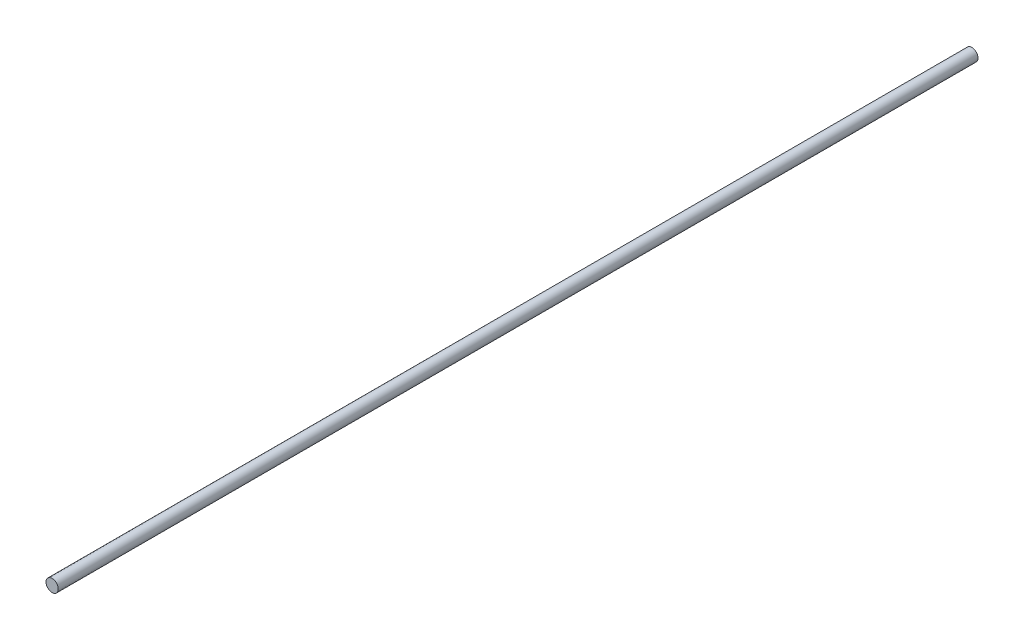
from build123d import *

# Parameters (mm, degrees)
SKETCH2_R           = 2
BOSS_EXTRUDE1_DEPTH = 300


with BuildPart() as part:
    # Sketch2 → Boss-Extrude1 (new body)
    with BuildSketch(Plane.XY):
        Circle(SKETCH2_R)
    extrude(amount=BOSS_EXTRUDE1_DEPTH)


solid = part.part
